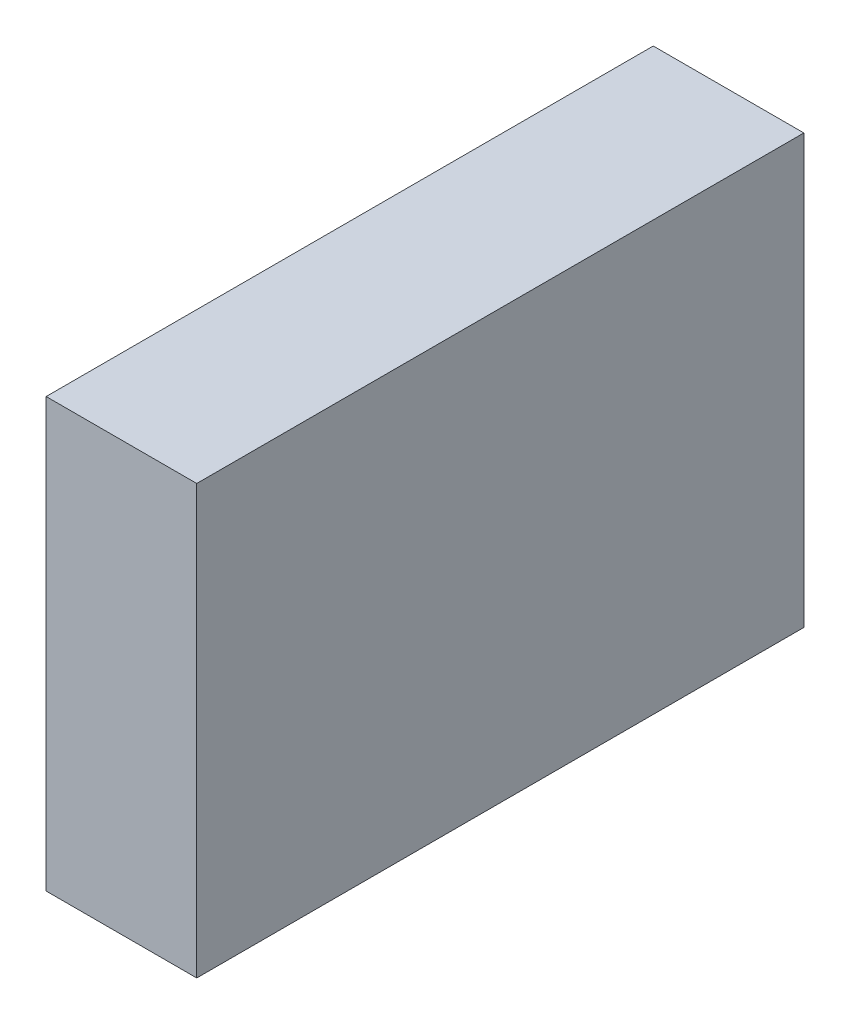
from build123d import *

# Parameters (mm, degrees)
SKETCH1_W           = 64.5
SKETCH1_H           = 45.5
BOSS_EXTRUDE1_DEPTH = 2
SKETCH2_W           = 64.5
SKETCH2_H           = 45.5
SKETCH2_W_2         = 28
SKETCH2_H_2         = 41.5
BOSS_EXTRUDE2_DEPTH = 14
CUT_EXTRUDE1_REACH  = 80.565
SKETCH3_R           = 14
SKETCH4_W           = 2.5
SKETCH4_H           = 39.5
CUT_EXTRUDE2_DEPTH  = 5.5
SKETCH5_W           = 28
SKETCH5_H           = 41.5
BOSS_EXTRUDE3_DEPTH = 10.16
SKETCH6_R           = 1.2
BOSS_EXTRUDE4_DEPTH = 5.08


with BuildPart() as part:
    # Sketch1 → Boss-Extrude1 (new body)
    with BuildSketch(Plane(origin=(0, 0, 0), x_dir=(0, 0, -1), z_dir=(1, 0, 0))):
        with Locations((30.25, 20.75)):
            Rectangle(SKETCH1_W, SKETCH1_H)
    extrude(amount=BOSS_EXTRUDE1_DEPTH)

    # Sketch2 → Boss-Extrude2 (add)
    with BuildSketch(Plane.ZY):
        with Locations((-30.25, 20.75)):
            Rectangle(SKETCH2_W, SKETCH2_H)
        with Locations((-46.5, 20.75)):
            Rectangle(SKETCH2_W_2, SKETCH2_H_2, mode=Mode.SUBTRACT)
        with Locations((-14, 20.75)):
            Rectangle(SKETCH2_W_2, SKETCH2_H_2, mode=Mode.SUBTRACT)
    extrude(amount=BOSS_EXTRUDE2_DEPTH)

    # Sketch3 → Cut-Extrude1 (cut, up to next)
    with BuildSketch(Plane(origin=(0, -2, 0), x_dir=(1, 0, 0), z_dir=(0, 1, 0)), mode=Mode.PRIVATE) as cut_extrude1_sk1:
        with Locations((-14, 14)):
            Circle(SKETCH3_R)
    cut_extrude1_tool1 = extrude(cut_extrude1_sk1.sketch, amount=CUT_EXTRUDE1_REACH, mode=Mode.PRIVATE) & part.part
    add(cut_extrude1_tool1.solids().sort_by_distance((-14, -2, -14))[0], mode=Mode.SUBTRACT)

    # Sketch4 → Cut-Extrude2 (cut)
    with BuildSketch(Plane.ZY.offset(14)):
        with Locations((-30.25, 20.75)):
            Rectangle(SKETCH4_W, SKETCH4_H)
    extrude(amount=-CUT_EXTRUDE2_DEPTH, mode=Mode.SUBTRACT)

    # Sketch5 → Boss-Extrude3 (add)
    with BuildSketch(Plane.ZY):
        with Locations((-46.5, 20.75)):
            Rectangle(SKETCH5_W, SKETCH5_H)
    extrude(amount=BOSS_EXTRUDE3_DEPTH)

    # Sketch6 → Boss-Extrude4 (add)
    with BuildSketch(Plane(origin=(0, 0, -62.5), x_dir=(-1, 0, 0), z_dir=(0, 0, -1))):
        with Locations(Location((11.968, 10.7, 0), (0, 0, 180))):
            Circle(SKETCH6_R)
        with Locations(Location((11.968, 19.68025612, 0), (0, 0, 180))):
            Circle(SKETCH6_R)
    extrude(amount=BOSS_EXTRUDE4_DEPTH)


solid = part.part
